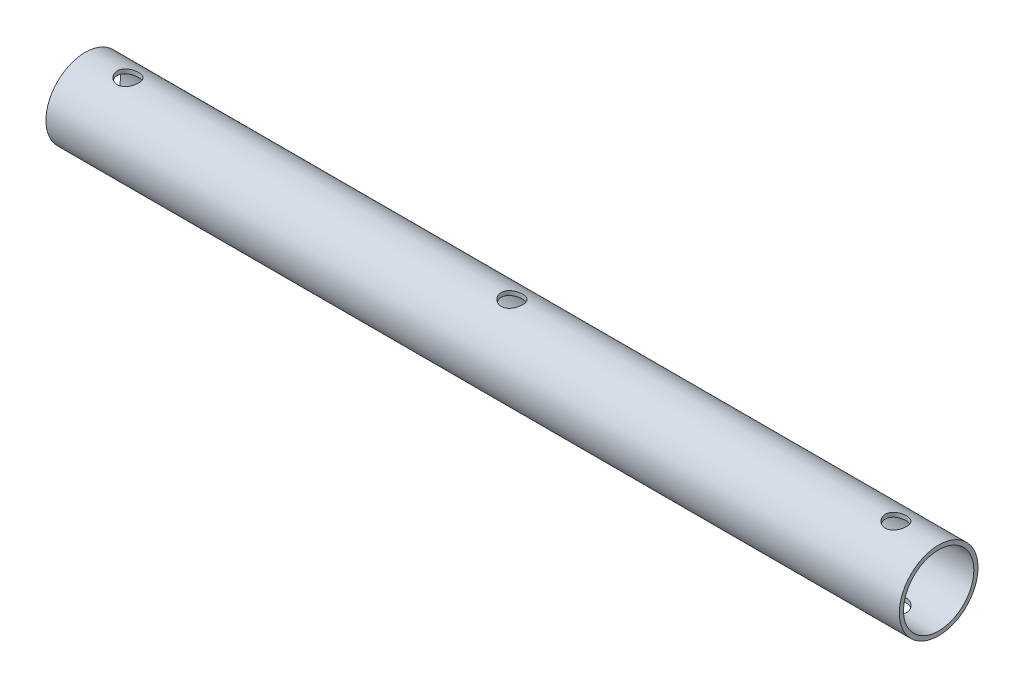
from build123d import *

# Parameters (mm, degrees)
SKETCH3_R               = 11.7094
SKETCH3_R_2             = 10.4648
BOSS_EXTRUDE1_DEPTH     = 254
CUT_EXTRUDE1_DEPTH      = 255.539230958
CUT_EXTRUDE1_DEPTH_BACK = 255.539230958
SKETCH4_R               = 3.175


with BuildPart() as part:
    # Sketch3 → Boss-Extrude1 (new body)
    with BuildSketch(Plane(origin=(0, 0, 0), x_dir=(0, 0, -1), z_dir=(1, 0, 0))):
        Circle(SKETCH3_R)
        Circle(SKETCH3_R_2, mode=Mode.SUBTRACT)
    extrude(amount=BOSS_EXTRUDE1_DEPTH)

    # Sketch4 → Cut-Extrude1 (cut, two sides: drawn at the far end of the back side and taken through both)
    with BuildSketch(Plane(origin=(0, 0, 0), x_dir=(1, 0, 0), z_dir=(0, 1, 0)).offset(-CUT_EXTRUDE1_DEPTH_BACK)):
        with Locations(Location((127, 0, 0), (0, 0, 90))):
            Circle(SKETCH4_R)
        with Locations(Location((12.7, 0, 0), (0, 0, 90))):
            Circle(SKETCH4_R)
        with Locations(Location((241.3, 0, 0), (0, 0, 90))):
            Circle(SKETCH4_R)
    extrude(amount=CUT_EXTRUDE1_DEPTH + CUT_EXTRUDE1_DEPTH_BACK, mode=Mode.SUBTRACT)


solid = part.part
